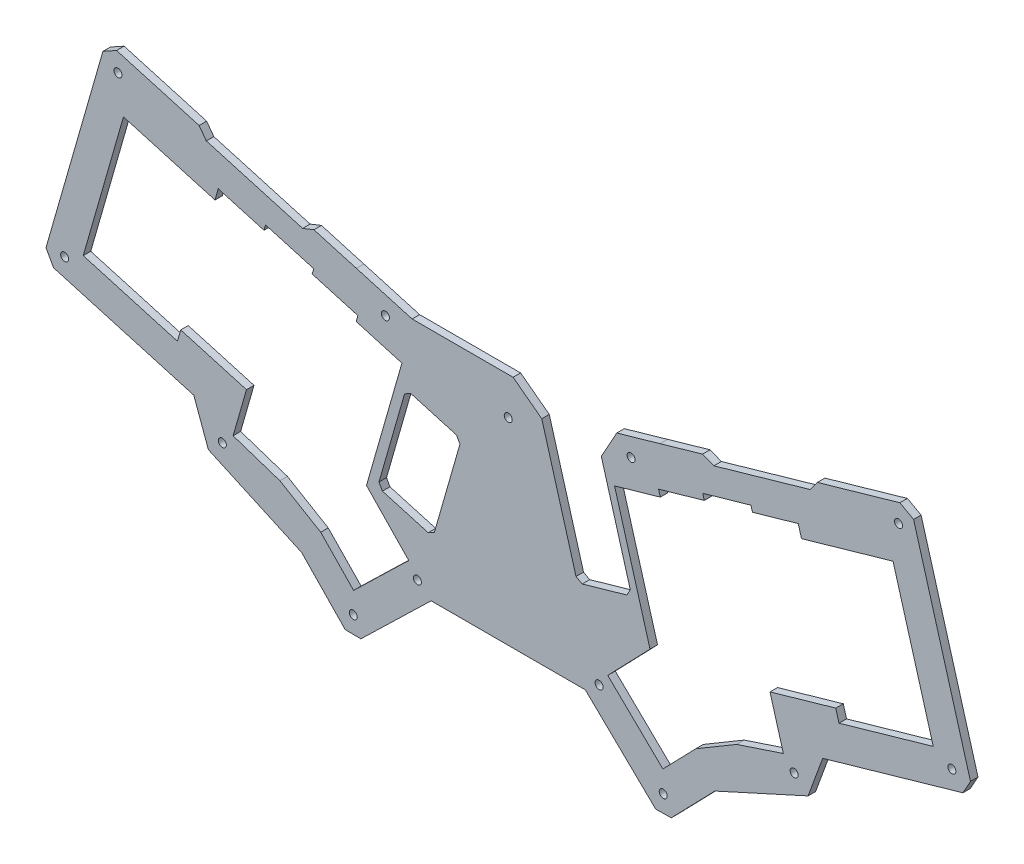
from build123d import *

# Parameters (mm, degrees)
ESQUISSE1_R        = 1.6
BOSS_EXTRU_1_DEPTH = 3


with BuildPart() as part:
    # Esquisse1 → Boss.-Extru.1 (new body)
    with BuildSketch(Plane.XY):
        Polygon((-130.649820486, -22.415487094), (-119.070790786, -62.796362516), (-120.442039466, -65.27016062), (-138.268849115, -70.381916029), (-140.742647218, -69.010667349), (-154.419403971, -21.314148304), (-165.848732708, -12.701531345), (-206.165691337, -12.701531345), (-221.686141291, -8.251113935), (-228.411595336, -6.322621021), (-237.526398495, -3.709541892), (-245.374022141, -1.459744369), (-249.872259625, -3.248768002), (-288.323340616, 7.774587685), (-291.190458161, 11.675149567), (-324.146226634, 21.123080509), (-329.606279511, 18.096325283), (-352.324375235, -61.131089881), (-349.297882974, -66.591026451), (-293.334748244, -82.638197107), (-287.498708924, -98.561018129), (-250.280154874, -115.48724507), (-232.892593163, -133.444615579), (-226.653475651, -133.542771169), (-198.570548361, -106.350948678), (-137.019971382, -106.350948678), (-108.937044092, -133.542771169), (-102.69792658, -133.444615579), (-85.310364869, -115.48724507), (-48.091810819, -98.561018129), (-42.255771499, -82.638197107), (13.707363231, -66.591026451), (16.733855492, -61.131089881), (-5.984240232, 18.096325283), (-11.444293109, 21.123080509), (-44.400061582, 11.675149567), (-47.267179127, 7.774587685), (-85.718260118, -3.248768002), (-90.216497602, -1.459744369), (-98.064121248, -3.709541892), (-107.178924407, -6.322621021), (-113.904378452, -8.251113935), (-124.479201425, -11.283395628), align=None)
        with Locations((-229.666591606, -126.713325795)):
            Circle(ESQUISSE1_R, mode=Mode.SUBTRACT)
        with Locations((-204.059552706, -101.880200807)):
            Circle(ESQUISSE1_R, mode=Mode.SUBTRACT)
        with Locations((-281.934339477, -93.401689518)):
            Circle(ESQUISSE1_R, mode=Mode.SUBTRACT)
        with Locations((-344.882804027, -60.574933915)):
            Circle(ESQUISSE1_R, mode=Mode.SUBTRACT)
        Polygon((-210.232188047, -30.001147656), (-224.390430785, -79.377961929), (-208.212806214, -96.161100182), (-207.491865187, -96.85509979), (-208.236606037, -97.572971364), (-229.533063287, -118.225792128), (-242.655085998, -104.673746846), (-258.969310369, -95.012679745), (-277.629290011, -88.825419148), (-272.289144354, -70.202118055), (-298.538981418, -62.6750984), (-299.849714513, -67.246167925), (-337.461409717, -56.461187875), (-321.404434006, -0.463858857), (-284.873898651, -10.938821309), (-283.564528345, -6.372504389), (-265.299260667, -11.609985616), (-264.679553884, -9.448811229), (-245.452786066, -14.960840928), (-246.072799476, -17.123084647), (-227.807531798, -22.360565873), (-228.496674065, -24.763890567), align=None, mode=Mode.SUBTRACT)
        Polygon((-187.078341197, -46.443029785), (-197.274945207, -82.010279702), (-199.748667041, -83.381665967), (-218.012930512, -78.145572016), (-219.384316777, -75.671850182), (-209.187712767, -40.104600265), (-206.713990933, -38.733214), (-188.449727462, -43.969307951), align=None, mode=Mode.SUBTRACT)
        with Locations((-105.923928137, -126.713325795)):
            Circle(ESQUISSE1_R, mode=Mode.SUBTRACT)
        with Locations((-131.530967037, -101.880200807)):
            Circle(ESQUISSE1_R, mode=Mode.SUBTRACT)
        with Locations((-53.656180266, -93.401689518)):
            Circle(ESQUISSE1_R, mode=Mode.SUBTRACT)
        Polygon((-106.057456456, -118.225792128), (-128.0696158, -96.878899722), (-127.377713529, -96.161100182), (-111.200088958, -79.377961929), (-125.358331696, -30.001147656), (-107.093845678, -24.763890567), (-107.782987945, -22.360565873), (-89.517720268, -17.123084647), (-90.137733677, -14.960840928), (-70.910965859, -9.448811229), (-70.291259076, -11.609985616), (-52.025991399, -6.372504389), (-50.716621092, -10.938821309), (-14.186085737, -0.463858857), (1.870889973, -56.461187875), (-35.740805231, -67.246167925), (-37.051538325, -62.6750984), (-63.301375389, -70.202118055), (-57.961229733, -88.825419148), (-76.621209374, -95.012679745), (-92.935433745, -104.673746846), align=None, mode=Mode.SUBTRACT)
        with Locations((9.292284284, -60.574933915)):
            Circle(ESQUISSE1_R, mode=Mode.SUBTRACT)
        with Locations((-167.795259872, -27.605548894)):
            Circle(ESQUISSE1_R, mode=Mode.SUBTRACT)
        with Locations((-323.590068827, 13.68165837)):
            Circle(ESQUISSE1_R, mode=Mode.SUBTRACT)
        with Locations((-216.832585966, -16.924131519)):
            Circle(ESQUISSE1_R, mode=Mode.SUBTRACT)
        with Locations((-118.757933777, -16.924131519)):
            Circle(ESQUISSE1_R, mode=Mode.SUBTRACT)
        with Locations((-12.000450916, 13.68165837)):
            Circle(ESQUISSE1_R, mode=Mode.SUBTRACT)
    extrude(amount=BOSS_EXTRU_1_DEPTH)


solid = part.part
